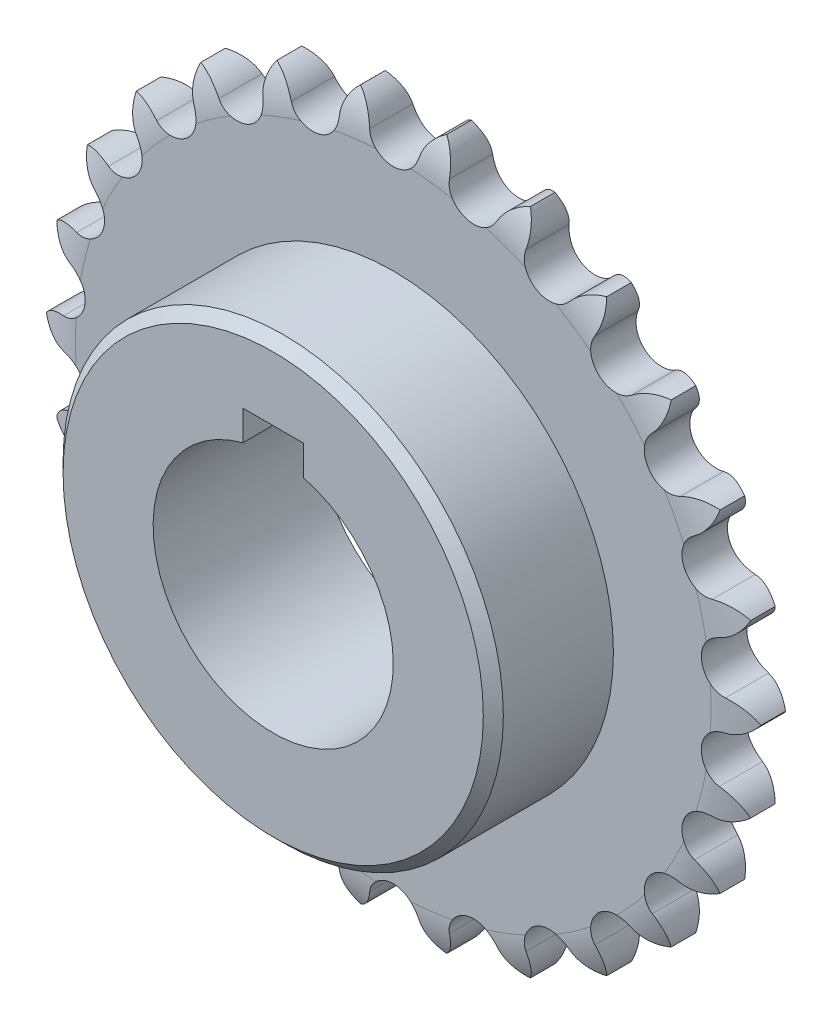
from build123d import *

# Parameters (mm, degrees)
ESBO_O1_R                = 19.05
RESSALTO_EXTRUS_O1_DEPTH = 3.6065
ESBO_O2_W                = 19.05
ESBO_O2_H                = 15.875
ESBO_O3_W                = 9.652
ESBO_O3_H                = 4.7625
CORTE_EXTRUS_O1_DEPTH    = 85.075305158
CHANFRO1_SIZE            = 1.5875


with BuildPart() as part:
    # Esboço1 → Ressalto-extrusão1 (new, symmetric)
    with BuildSketch(Plane.XY):
        with BuildLine():
            ThreePointArc((6.832202969, 56.268253798), (4.963717242, 54.655608441), (3.92972164, 52.414466532))
            ThreePointArc((3.92972164, 52.414466532), (0, 49.2633), (-3.92972164, 52.414466532))
            ThreePointArc((-3.92972164, 52.414466532), (-4.963717242, 54.655608441), (-6.832202969, 56.268253798))
            ThreePointArc((-6.832202969, 56.268253798), (-8.260462601, 54.255311081), (-8.728071805, 51.831841339))
            ThreePointArc((-8.728071805, 51.831841339), (-11.789479364, 47.831798034), (-16.359133948, 49.950953449))
            ThreePointArc((-16.359133948, 49.950953449), (-17.899423881, 51.879520503), (-20.099546103, 52.998147414))
            ThreePointArc((-20.099546103, 52.998147414), (-21.004574383, 50.701892251), (-20.878621442, 48.236937928))
            ThreePointArc((-20.878621442, 48.236937928), (-22.893797041, 43.620485829), (-27.837812853, 44.584472516))
            ThreePointArc((-27.837812853, 44.584472516), (-29.794881066, 46.088383408), (-32.198776677, 46.647981343))
            ThreePointArc((-32.198776677, 46.647981343), (-32.52797665, 44.201863738), (-31.815781492, 41.838679019))
            ThreePointArc((-31.815781492, 41.838679019), (-32.66761045, 36.87410954), (-37.698659262, 36.626904099))
            ThreePointArc((-37.698659262, 36.626904099), (-39.958768064, 37.618756993), (-42.426731389, 37.586804154))
            ThreePointArc((-42.426731389, 37.586804154), (-42.160971149, 35.132983571), (-40.903923967, 33.008908163))
            ThreePointArc((-40.903923967, 33.008908163), (-40.542901081, 27.984744038), (-45.368596624, 26.540713148))
            ThreePointArc((-45.368596624, 26.540713148), (-47.800396705, 26.962865161), (-50.188998687, 26.341218531))
            ThreePointArc((-50.188998687, 26.341218531), (-49.343723254, 24.022302103), (-47.614879061, 22.260779547))
            ThreePointArc((-47.614879061, 22.260779547), (-46.061985668, 17.469006932), (-50.401876058, 14.912072421))
            ThreePointArc((-50.401876058, 14.912072421), (-52.864040038, 14.739989612), (-55.034463811, 13.564777033))
            ThreePointArc((-55.034463811, 13.564777033), (-53.65879752, 11.515531753), (-51.558630457, 10.218935338))
            ThreePointArc((-51.558630457, 10.218935338), (-48.904115077, 5.93803464), (-52.505981658, 2.416796248))
            ThreePointArc((-52.505981658, 2.416796248), (-54.855417516, 1.660479444), (-56.68152594, 0))
            ThreePointArc((-56.68152594, 0), (-54.855417516, -1.660479444), (-52.505981658, -2.416796248))
            ThreePointArc((-52.505981658, -2.416796248), (-48.904115077, -5.93803464), (-51.558630457, -10.218935338))
            ThreePointArc((-51.558630457, -10.218935338), (-53.65879752, -11.515531753), (-55.034463811, -13.564777033))
            ThreePointArc((-55.034463811, -13.564777033), (-52.864040038, -14.739989612), (-50.401876058, -14.912072421))
            ThreePointArc((-50.401876058, -14.912072421), (-46.061985668, -17.469006932), (-47.614879061, -22.260779547))
            ThreePointArc((-47.614879061, -22.260779547), (-49.343723254, -24.022302103), (-50.188998687, -26.341218531))
            ThreePointArc((-50.188998687, -26.341218531), (-47.800396705, -26.962865161), (-45.368596624, -26.540713148))
            ThreePointArc((-45.368596624, -26.540713148), (-40.542901081, -27.984744038), (-40.903923967, -33.008908163))
            ThreePointArc((-40.903923967, -33.008908163), (-42.160971149, -35.132983571), (-42.426731389, -37.586804154))
            ThreePointArc((-42.426731389, -37.586804154), (-39.958768064, -37.618756993), (-37.698659262, -36.626904099))
            ThreePointArc((-37.698659262, -36.626904099), (-32.66761045, -36.87410954), (-31.815781492, -41.838679019))
            ThreePointArc((-31.815781492, -41.838679019), (-32.52797665, -44.201863738), (-32.198776677, -46.647981343))
            ThreePointArc((-32.198776677, -46.647981343), (-29.794881066, -46.088383408), (-27.837812853, -44.584472516))
            ThreePointArc((-27.837812853, -44.584472516), (-22.893797041, -43.620485829), (-20.878621442, -48.236937928))
            ThreePointArc((-20.878621442, -48.236937928), (-21.004574383, -50.701892251), (-20.099546103, -52.998147414))
            ThreePointArc((-20.099546103, -52.998147414), (-17.899423881, -51.879520503), (-16.359133948, -49.950953449))
            ThreePointArc((-16.359133948, -49.950953449), (-11.789479364, -47.831798034), (-8.728071805, -51.831841339))
            ThreePointArc((-8.728071805, -51.831841339), (-8.260462601, -54.255311081), (-6.832202969, -56.268253798))
            ThreePointArc((-6.832202969, -56.268253798), (-4.963717242, -54.655608441), (-3.92972164, -52.414466532))
            ThreePointArc((-3.92972164, -52.414466532), (0, -49.2633), (3.92972164, -52.414466532))
            ThreePointArc((3.92972164, -52.414466532), (4.963717242, -54.655608441), (6.832202969, -56.268253798))
            ThreePointArc((6.832202969, -56.268253798), (8.260462601, -54.255311081), (8.728071805, -51.831841339))
            ThreePointArc((8.728071805, -51.831841339), (11.789479364, -47.831798034), (16.359133948, -49.950953449))
            ThreePointArc((16.359133948, -49.950953449), (17.899423881, -51.879520503), (20.099546103, -52.998147414))
            ThreePointArc((20.099546103, -52.998147414), (21.004574383, -50.701892251), (20.878621442, -48.236937928))
            ThreePointArc((20.878621442, -48.236937928), (22.893797041, -43.620485829), (27.837812853, -44.584472516))
            ThreePointArc((27.837812853, -44.584472516), (29.794881066, -46.088383408), (32.198776677, -46.647981343))
            ThreePointArc((32.198776677, -46.647981343), (32.52797665, -44.201863738), (31.815781492, -41.838679019))
            ThreePointArc((31.815781492, -41.838679019), (32.66761045, -36.87410954), (37.698659262, -36.626904099))
            ThreePointArc((37.698659262, -36.626904099), (39.958768064, -37.618756993), (42.426731389, -37.586804154))
            ThreePointArc((42.426731389, -37.586804154), (42.160971149, -35.132983571), (40.903923967, -33.008908163))
            ThreePointArc((40.903923967, -33.008908163), (40.542901081, -27.984744038), (45.368596624, -26.540713148))
            ThreePointArc((45.368596624, -26.540713148), (47.800396705, -26.962865161), (50.188998687, -26.341218531))
            ThreePointArc((50.188998687, -26.341218531), (49.343723254, -24.022302103), (47.614879061, -22.260779547))
            ThreePointArc((47.614879061, -22.260779547), (46.061985668, -17.469006932), (50.401876058, -14.912072421))
            ThreePointArc((50.401876058, -14.912072421), (52.864040038, -14.739989612), (55.034463811, -13.564777033))
            ThreePointArc((55.034463811, -13.564777033), (53.65879752, -11.515531753), (51.558630457, -10.218935338))
            ThreePointArc((51.558630457, -10.218935338), (48.904115077, -5.93803464), (52.505981658, -2.416796248))
            ThreePointArc((52.505981658, -2.416796248), (54.855417516, -1.660479444), (56.68152594, 0))
            ThreePointArc((56.68152594, 0), (54.855417516, 1.660479444), (52.505981658, 2.416796248))
            ThreePointArc((52.505981658, 2.416796248), (48.904115077, 5.93803464), (51.558630457, 10.218935338))
            ThreePointArc((51.558630457, 10.218935338), (53.65879752, 11.515531753), (55.034463811, 13.564777033))
            ThreePointArc((55.034463811, 13.564777033), (52.864040038, 14.739989612), (50.401876058, 14.912072421))
            ThreePointArc((50.401876058, 14.912072421), (46.061985668, 17.469006932), (47.614879061, 22.260779547))
            ThreePointArc((47.614879061, 22.260779547), (49.343723254, 24.022302103), (50.188998687, 26.341218531))
            ThreePointArc((50.188998687, 26.341218531), (47.800396705, 26.962865161), (45.368596624, 26.540713148))
            ThreePointArc((45.368596624, 26.540713148), (40.542901081, 27.984744038), (40.903923967, 33.008908163))
            ThreePointArc((40.903923967, 33.008908163), (42.160971149, 35.132983571), (42.426731389, 37.586804154))
            ThreePointArc((42.426731389, 37.586804154), (39.958768064, 37.618756993), (37.698659262, 36.626904099))
            ThreePointArc((37.698659262, 36.626904099), (32.66761045, 36.87410954), (31.815781492, 41.838679019))
            ThreePointArc((31.815781492, 41.838679019), (32.52797665, 44.201863738), (32.198776677, 46.647981343))
            ThreePointArc((32.198776677, 46.647981343), (29.794881066, 46.088383408), (27.837812853, 44.584472516))
            ThreePointArc((27.837812853, 44.584472516), (22.893797041, 43.620485829), (20.878621442, 48.236937928))
            ThreePointArc((20.878621442, 48.236937928), (21.004574383, 50.701892251), (20.099546103, 52.998147414))
            ThreePointArc((20.099546103, 52.998147414), (17.899423881, 51.879520503), (16.359133948, 49.950953449))
            ThreePointArc((16.359133948, 49.950953449), (11.789479364, 47.831798034), (8.728071805, 51.831841339))
            ThreePointArc((8.728071805, 51.831841339), (8.260462601, 54.255311081), (6.832202969, 56.268253798))
        make_face()
        Circle(ESBO_O1_R, mode=Mode.SUBTRACT)
    extrude(amount=RESSALTO_EXTRUS_O1_DEPTH, both=True)

    # Esboço2 → Revolução1 (revolve)
    with BuildSketch(Plane(origin=(0, 0, 0), x_dir=(0, 0, -1), z_dir=(1, 0, 0))):
        with Locations((-13.1315, 26.9875)):
            Rectangle(ESBO_O2_W, ESBO_O2_H)
    revolve(axis=Axis((0, 0, 0), (0, 0, 1)))

    # Esboço3 → Corte-extrusão1 (cut, through all)
    with BuildSketch(Plane.XY.offset(22.6565)):
        with Locations((0, 20.809820862)):
            Rectangle(ESBO_O3_W, ESBO_O3_H)
    extrude(amount=-CORTE_EXTRUS_O1_DEPTH, mode=Mode.SUBTRACT)

    # Esboço4 → Corte-Revolução1 (revolve, cut)
    with BuildSketch(Plane(origin=(0, 0, 0), x_dir=(0, 0, -1), z_dir=(1, 0, 0))):
        with BuildLine():
            ThreePointArc((-3.6065, 50.419), (-3.1554322, 53.773647518), (-1.834270084, 56.89))
            Line((-1.834270084, 56.89), (-7.149678633, 56.89))
            Line((-7.149678633, 56.89), (-7.149678633, 50.419))
            Line((-7.149678633, 50.419), (-3.6065, 50.419))
        make_face()
        with BuildLine():
            Line((3.6065, 50.419), (7.149678633, 50.419))
            Line((7.149678633, 50.419), (7.149678633, 56.89))
            Line((7.149678633, 56.89), (1.834270084, 56.89))
            ThreePointArc((1.834270084, 56.89), (3.1554322, 53.773647518), (3.6065, 50.419))
        make_face()
    revolve(axis=Axis((0, 0, 0), (0, 0, -1)), mode=Mode.SUBTRACT)

    # Chanfro1
    chanfro1_edges = [part.edges().sort_by_distance(p)[0] for p in [
        (0, -34.925, 22.6565),
    ]]
    chamfer(chanfro1_edges, length=CHANFRO1_SIZE)


solid = part.part
